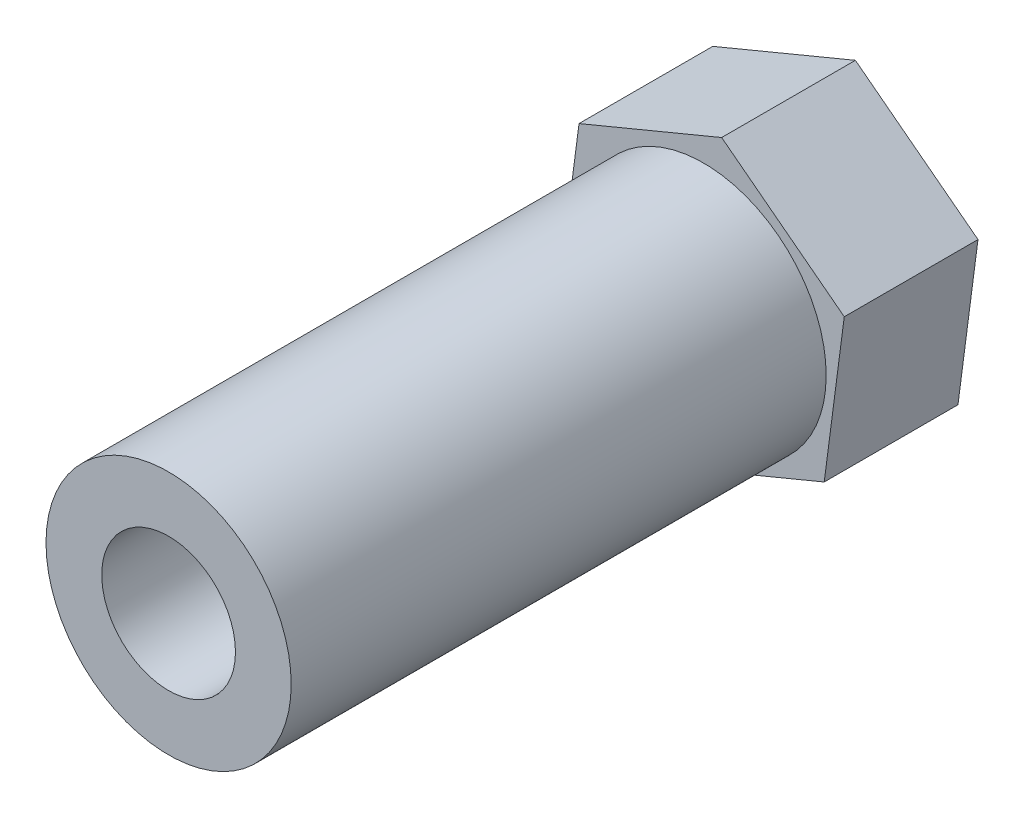
from build123d import *

# Parameters (mm, degrees)
BOSS_EXTRUDE1_DEPTH = 6
SKETCH3_R           = 5.5
BOSS_EXTRUDE2_DEPTH = 24
SKETCH4_R           = 1.5
CUT_EXTRUDE1_DEPTH  = 6
SKETCH5_R           = 3
CUT_EXTRUDE2_DEPTH  = 24


with BuildPart() as part:
    # Sketch1 → Boss-Extrude1 (new body)
    with BuildSketch(Plane.XY):
        Polygon((0.950381036, -2.263552428), (1.849306406, 4.606086076), (-3.650512368, 8.819397535), (-10.049256513, 6.163070489), (-10.948181883, -0.706568015), (-5.448363108, -4.919879474), align=None)
    extrude(amount=BOSS_EXTRUDE1_DEPTH)

    # Sketch3 → Boss-Extrude2 (add)
    with BuildSketch(Plane.XY.offset(6)):
        with Locations((-4.462077205, 1.925315909)):
            Circle(SKETCH3_R)
    extrude(amount=BOSS_EXTRUDE2_DEPTH)

    # Sketch4 → Cut-Extrude1 (cut)
    with BuildSketch(Plane(origin=(0, 0, 0), x_dir=(-1, 0, 0), z_dir=(0, 0, -1))):
        with Locations((4.462077205, 1.925315909)):
            Circle(SKETCH4_R)
    extrude(amount=-CUT_EXTRUDE1_DEPTH, mode=Mode.SUBTRACT)

    # Sketch5 → Cut-Extrude2 (cut)
    with BuildSketch(Plane.XY.offset(30)):
        with Locations((-4.462077205, 1.925315909)):
            Circle(SKETCH5_R)
    extrude(amount=-CUT_EXTRUDE2_DEPTH, mode=Mode.SUBTRACT)


solid = part.part
